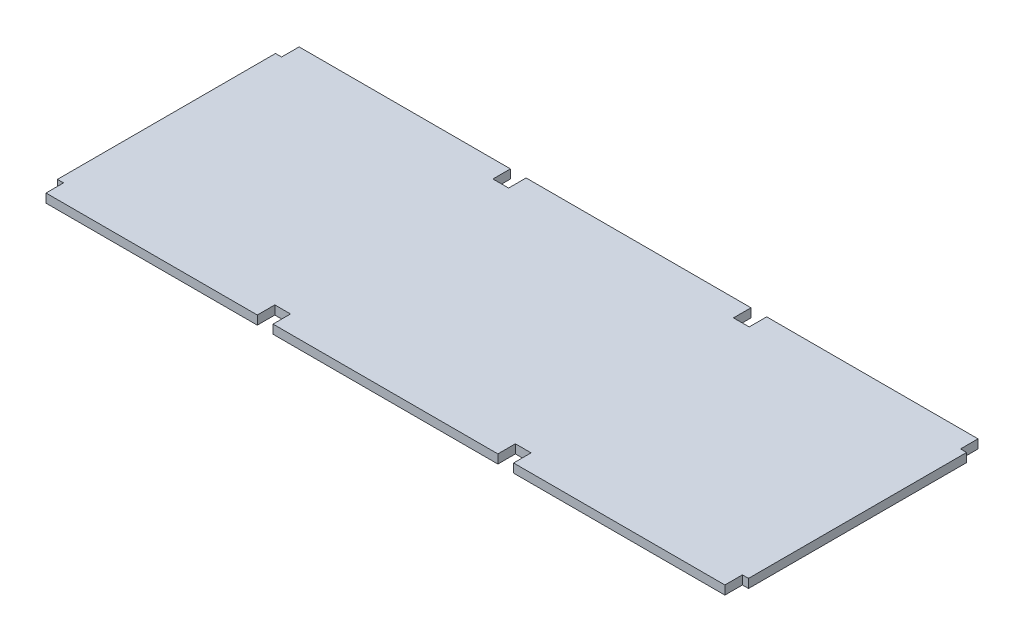
from build123d import *

# Parameters (mm, degrees)
BOSS_EXTRUDE1_DEPTH = 3.9


with BuildPart() as part:
    # Sketch1 → Boss-Extrude1 (new body)
    with BuildSketch(Plane(origin=(0, 0, 0), x_dir=(1, 0, 0), z_dir=(0, 1, 0))):
        Polygon((0, 0), (0, 96.5), (2.7, 96.5), (2.7, 104.25), (96.2, 104.25), (96.2, 96.5), (103.15, 96.5), (103.15, 104.25), (202.65, 104.25), (202.65, 96.5), (209.6, 96.5), (209.6, 104.25), (303.1, 104.25), (303.1, 96.5), (305.8, 96.5), (305.8, 0), (303.1, 0), (303.1, -7.75), (209.6, -7.75), (209.6, 0), (202.65, 0), (202.65, -7.75), (103.15, -7.75), (103.15, 0), (96.2, 0), (96.2, -7.75), (2.7, -7.75), (2.7, 0), align=None)
    extrude(amount=BOSS_EXTRUDE1_DEPTH)


solid = part.part
